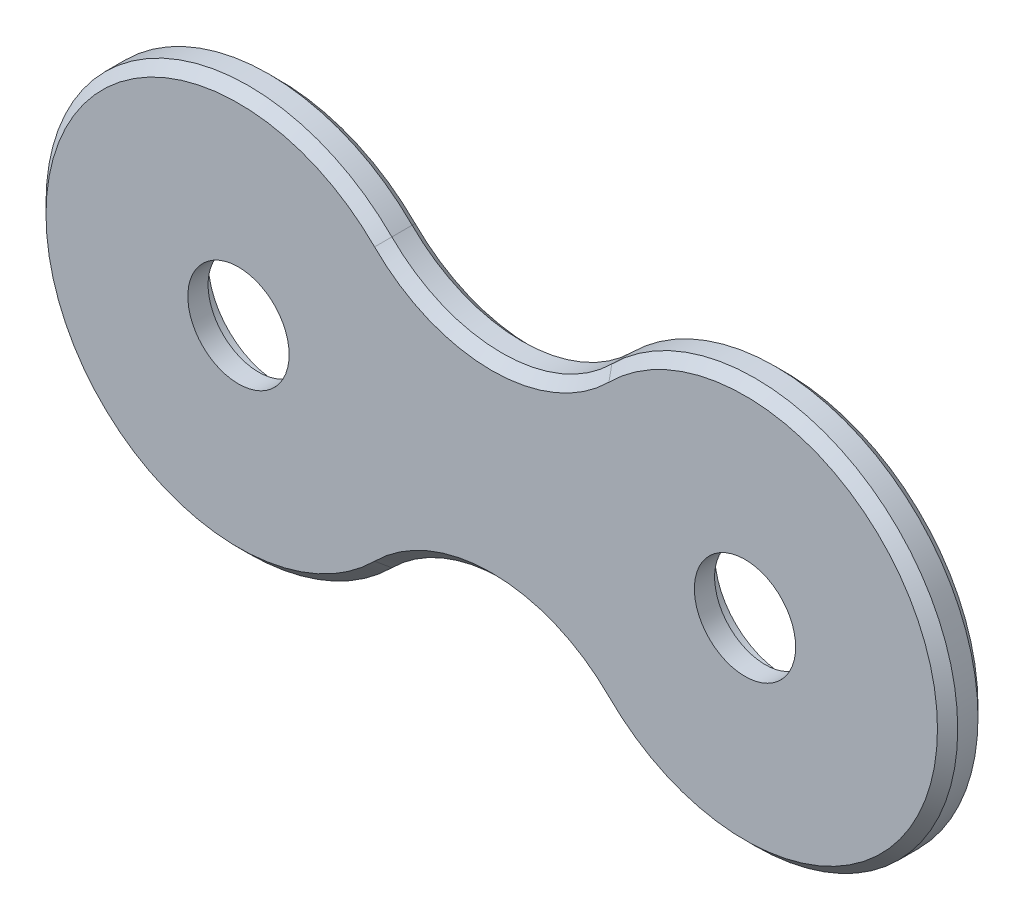
from build123d import *

# Parameters (mm, degrees)
SKETCH1_R           = 2.5
BOSS_EXTRUDE1_DEPTH = 2
CHAMFER1_SIZE       = 0.5
SKETCH2_R           = 3.5
CUT_EXTRUDE1_DEPTH  = 1


with BuildPart() as part:
    # Sketch1 → Boss-Extrude1 (new body)
    with BuildSketch(Plane.XY):
        with BuildLine():
            ThreePointArc((17.928932188, -7.071067812), (35, 0), (17.928932188, 7.071067812))
            ThreePointArc((17.928932188, 7.071067812), (12.5, 4.82233047), (7.071067812, 7.071067812))
            ThreePointArc((7.071067812, 7.071067812), (-10, 0), (7.071067812, -7.071067812))
            ThreePointArc((7.071067812, -7.071067812), (12.5, -4.82233047), (17.928932188, -7.071067812))
        make_face()
        with Locations((25, 0)):
            Circle(SKETCH1_R, mode=Mode.SUBTRACT)
        Circle(SKETCH1_R, mode=Mode.SUBTRACT)
    extrude(amount=BOSS_EXTRUDE1_DEPTH)

    # Chamfer1
    chamfer1_edges = [part.edges().sort_by_distance(p)[0] for p in [
        (12.5, -4.82233047, 2),
        (35, 0, 2),
        (12.5, 4.82233047, 2),
        (35, 0, 0),
        (12.5, -4.82233047, 0),
        (-10, 0, 0),
        (12.5, 4.82233047, 0),
        (-10, 0, 2),
    ]]
    chamfer(chamfer1_edges, length=CHAMFER1_SIZE)

    # Sketch2 → Cut-Extrude1 (cut)
    with BuildSketch(Plane.XY):
        Circle(SKETCH2_R)
        with Locations((25, 0)):
            Circle(SKETCH2_R)
    extrude(amount=CUT_EXTRUDE1_DEPTH, mode=Mode.SUBTRACT)


solid = part.part
